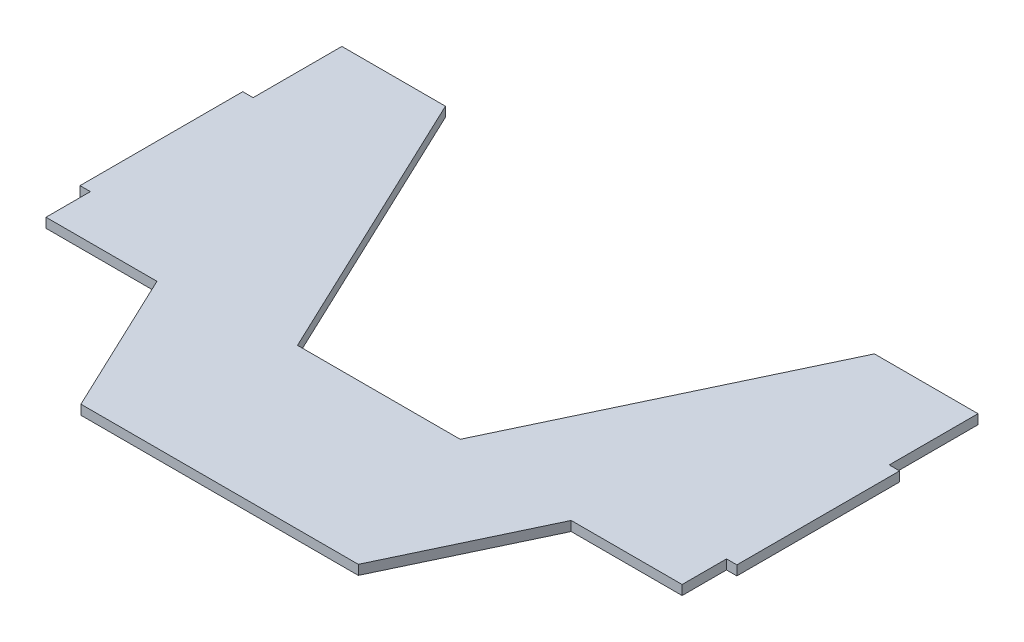
from build123d import *

# Parameters (mm, degrees)
SKETCH1_W           = 86
SKETCH1_H           = 40
BOSS_EXTRUDE1_DEPTH = 1.3
SKETCH2_W           = 1.4
SKETCH2_H           = 22
BOSS_EXTRUDE2_DEPTH = 1.3
CUT_EXTRUDE1_DEPTH  = 49.713961038
BOSS_EXTRUDE3_DEPTH = 1.3


with BuildPart() as part:
    # Sketch1 → Boss-Extrude1 (new body)
    with BuildSketch(Plane(origin=(0, 0, 0), x_dir=(1, 0, 0), z_dir=(0, 1, 0))):
        Rectangle(SKETCH1_W, SKETCH1_H)
    extrude(amount=BOSS_EXTRUDE1_DEPTH)

    # Sketch2 → Boss-Extrude2 (add)
    with BuildSketch(Plane(origin=(0, 1.3, 0), x_dir=(1, 0, 0), z_dir=(0, 1, 0))):
        with Locations((-43.7, -3)):
            Rectangle(SKETCH2_W, SKETCH2_H)
        with Locations((43.7, -3)):
            Rectangle(SKETCH2_W, SKETCH2_H)
    extrude(amount=-BOSS_EXTRUDE2_DEPTH)

    # Sketch3 → Cut-Extrude1 (cut, through all)
    with BuildSketch(Plane(origin=(0, 1.3, 0), x_dir=(1, 0, 0), z_dir=(0, 1, 0))):
        Polygon((29, 20), (-29, 20), (-11, -18), (11, -18), align=None)
    extrude(amount=-CUT_EXTRUDE1_DEPTH, mode=Mode.SUBTRACT)

    # Sketch4 → Boss-Extrude3 (add)
    with BuildSketch(Plane(origin=(0, 0, 0), x_dir=(1, 0, 0), z_dir=(0, 1, 0))):
        Polygon((-28, -20), (-18.75, -39.527777778), (18.75, -39.527777778), (28, -20), align=None)
    extrude(amount=BOSS_EXTRUDE3_DEPTH)


solid = part.part
